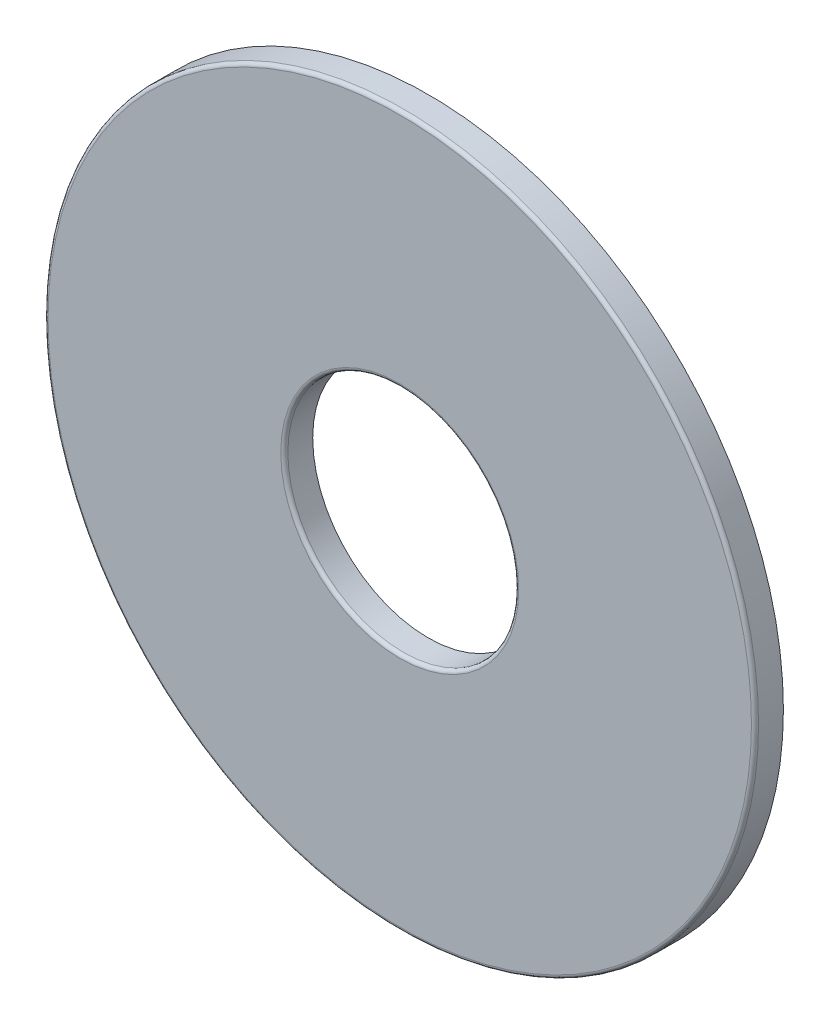
from build123d import *

# Parameters (mm, degrees)
SKETCH1_R           = 10
SKETCH1_R_2         = 3.25
BOSS_EXTRUDE1_DEPTH = 0.8
FILLET1_R           = 0.1


with BuildPart() as part:
    # Sketch1 → Boss-Extrude1 (new body)
    with BuildSketch(Plane.XY):
        Circle(SKETCH1_R)
        Circle(SKETCH1_R_2, mode=Mode.SUBTRACT)
    extrude(amount=BOSS_EXTRUDE1_DEPTH)

    # Fillet1
    fillet1_edges = [part.edges().sort_by_distance(p)[0] for p in [
        (-10, 0, 0.8),
        (-3.25, 0, 0.8),
    ]]
    fillet(fillet1_edges, radius=FILLET1_R)


solid = part.part
